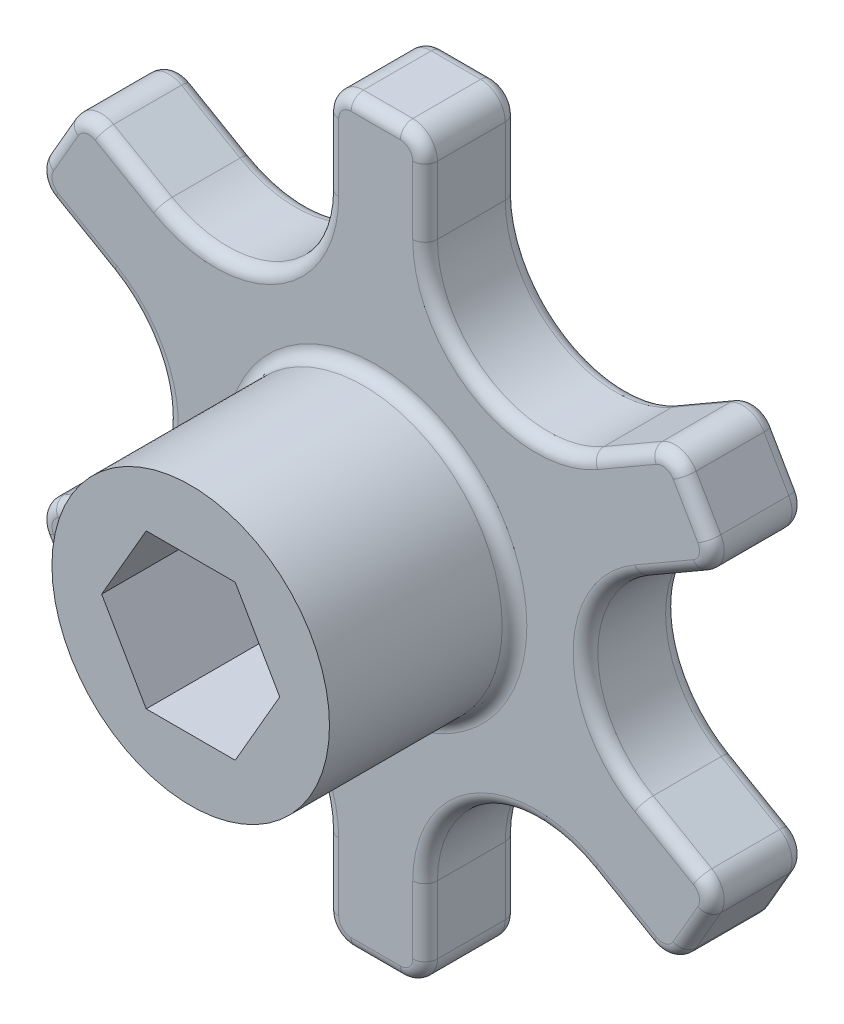
from build123d import *

# Parameters (mm, degrees)
BOSS_EXTRUDE1_DEPTH = 9.525
SKETCH2_R           = 14.2875
BOSS_EXTRUDE3_DEPTH = 19.05
FILLET3_R           = 1.27


with BuildPart() as part:
    # Sketch1 → Boss-Extrude1 (new body)
    with BuildSketch(Plane.XY):
        with BuildLine():
            Line((-5.08, 35.56), (-5.08, 28.596158833))
            ThreePointArc((-5.08, 28.596158833), (-10.795, 18.697488468), (-22.225, 18.697488468))
            Line((-22.225, 18.697488468), (-28.255863359, 22.179409051))
            ThreePointArc((-28.255863359, 22.179409051), (-30.183263733, 22.433156124), (-31.725567884, 21.249704526))
            Line((-31.725567884, 21.249704526), (-34.265567884, 16.850295474))
            ThreePointArc((-34.265567884, 16.850295474), (-34.519314957, 14.9228951), (-33.335863359, 13.380590949))
            Line((-33.335863359, 13.380590949), (-27.305, 9.898670365))
            ThreePointArc((-27.305, 9.898670365), (-21.59, 0), (-27.305, -9.898670365))
            Line((-27.305, -9.898670365), (-33.335863359, -13.380590949))
            ThreePointArc((-33.335863359, -13.380590949), (-34.519314957, -14.9228951), (-34.265567884, -16.850295474))
            Line((-34.265567884, -16.850295474), (-31.725567884, -21.249704526))
            ThreePointArc((-31.725567884, -21.249704526), (-30.183263733, -22.433156124), (-28.255863359, -22.179409051))
            Line((-28.255863359, -22.179409051), (-22.225, -18.697488468))
            ThreePointArc((-22.225, -18.697488468), (-10.795, -18.697488468), (-5.08, -28.596158833))
            Line((-5.08, -28.596158833), (-5.08, -35.56))
            ThreePointArc((-5.08, -35.56), (-4.336051224, -37.356051224), (-2.54, -38.1))
            Line((-2.54, -38.1), (2.54, -38.1))
            ThreePointArc((2.54, -38.1), (4.336051224, -37.356051224), (5.08, -35.56))
            Line((5.08, -35.56), (5.08, -28.596158833))
            ThreePointArc((5.08, -28.596158833), (10.795, -18.697488468), (22.225, -18.697488468))
            Line((22.225, -18.697488468), (28.255863359, -22.179409051))
            ThreePointArc((28.255863359, -22.179409051), (30.183263733, -22.433156124), (31.725567884, -21.249704526))
            Line((31.725567884, -21.249704526), (34.265567884, -16.850295474))
            ThreePointArc((34.265567884, -16.850295474), (34.519314957, -14.9228951), (33.335863359, -13.380590949))
            Line((33.335863359, -13.380590949), (27.305, -9.898670365))
            ThreePointArc((27.305, -9.898670365), (21.59, 0), (27.305, 9.898670365))
            Line((27.305, 9.898670365), (33.335863359, 13.380590949))
            ThreePointArc((33.335863359, 13.380590949), (34.519314957, 14.9228951), (34.265567884, 16.850295474))
            Line((34.265567884, 16.850295474), (31.725567884, 21.249704526))
            ThreePointArc((31.725567884, 21.249704526), (30.183263733, 22.433156124), (28.255863359, 22.179409051))
            Line((28.255863359, 22.179409051), (22.225, 18.697488468))
            ThreePointArc((22.225, 18.697488468), (10.795, 18.697488468), (5.08, 28.596158833))
            Line((5.08, 28.596158833), (5.08, 35.56))
            ThreePointArc((5.08, 35.56), (4.336051224, 37.356051224), (2.54, 38.1))
            Line((2.54, 38.1), (-2.54, 38.1))
            ThreePointArc((-2.54, 38.1), (-4.336051224, 37.356051224), (-5.08, 35.56))
        make_face()
    extrude(amount=BOSS_EXTRUDE1_DEPTH)

    # Sketch2 → Boss-Extrude3 (add)
    with BuildSketch(Plane.XY.offset(9.525)):
        with Locations(Location((0, 0, 0), (0, 0, 180))):
            Circle(SKETCH2_R)
        Polygon((9.165435523, 0), (4.582717762, 7.9375), (-4.582717762, 7.9375), (-9.165435523, 0), (-4.582717762, -7.9375), (4.582717762, -7.9375), align=None, mode=Mode.SUBTRACT)
    extrude(amount=BOSS_EXTRUDE3_DEPTH)

    # Fillet3
    fillet3_edges = [part.edges().sort_by_distance(p)[0] for p in [
        (30.183263733, -22.433156124, 9.525),
        (14.2875, 0, 9.525),
        (32.995567884, -19.05, 9.525),
        (34.519314957, -14.9228951, 9.525),
        (30.320431679, -11.639630657, 9.525),
        (21.59, 0, 9.525),
        (30.320431679, 11.639630657, 9.525),
        (34.519314957, 14.9228951, 9.525),
        (32.995567884, 19.05, 9.525),
        (-4.336051224, 37.356051224, 9.525),
        (30.183263733, 22.433156124, 9.525),
        (25.240431679, 20.438448759, 9.525),
        (10.795, 18.697488468, 9.525),
        (5.08, 32.078079416, 9.525),
        (-5.08, 32.078079416, 9.525),
        (-10.795, 18.697488468, 9.525),
        (-25.240431679, 20.438448759, 9.525),
        (-30.183263733, 22.433156124, 9.525),
        (-32.995567884, 19.05, 9.525),
        (5.08, 32.078079416, 0),
        (10.795, 18.697488468, 0),
        (25.240431679, 20.438448759, 0),
        (30.183263733, 22.433156124, 0),
        (32.995567884, 19.05, 0),
        (34.519314957, 14.9228951, 0),
        (30.320431679, 11.639630657, 0),
        (21.59, 0, 0),
        (-34.519314957, 14.9228951, 9.525),
        (30.320431679, -11.639630657, 0),
        (34.519314957, -14.9228951, 0),
        (32.995567884, -19.05, 0),
        (30.183263733, -22.433156124, 0),
        (25.240431679, -20.438448759, 0),
        (10.795, -18.697488468, 0),
        (5.08, -32.078079416, 0),
        (4.336051224, -37.356051224, 0),
        (0, -38.1, 0),
        (-4.336051224, -37.356051224, 0),
        (-30.320431679, 11.639630657, 9.525),
        (-5.08, -32.078079416, 0),
        (-10.795, -18.697488468, 0),
        (-25.240431679, -20.438448759, 0),
        (-30.183263733, -22.433156124, 0),
        (-32.995567884, -19.05, 0),
        (-34.519314957, -14.9228951, 0),
        (-30.320431679, -11.639630657, 0),
        (-21.59, 0, 0),
        (-30.320431679, 11.639630657, 0),
        (-34.519314957, 14.9228951, 0),
        (-21.59, 0, 9.525),
        (-32.995567884, 19.05, 0),
        (-30.183263733, 22.433156124, 0),
        (-25.240431679, 20.438448759, 0),
        (-10.795, 18.697488468, 0),
        (-5.08, 32.078079416, 0),
        (-4.336051224, 37.356051224, 0),
        (0, 38.1, 0),
        (4.336051224, 37.356051224, 0),
        (-30.320431679, -11.639630657, 9.525),
        (4.336051224, 37.356051224, 9.525),
        (-34.519314957, -14.9228951, 9.525),
        (-32.995567884, -19.05, 9.525),
        (-30.183263733, -22.433156124, 9.525),
        (-25.240431679, -20.438448759, 9.525),
        (-10.795, -18.697488468, 9.525),
        (-5.08, -32.078079416, 9.525),
        (-4.336051224, -37.356051224, 9.525),
        (0, -38.1, 9.525),
        (4.336051224, -37.356051224, 9.525),
        (5.08, -32.078079416, 9.525),
        (0, 38.1, 9.525),
        (10.795, -18.697488468, 9.525),
        (25.240431679, -20.438448759, 9.525),
    ]]
    fillet(fillet3_edges, radius=FILLET3_R)


solid = part.part
